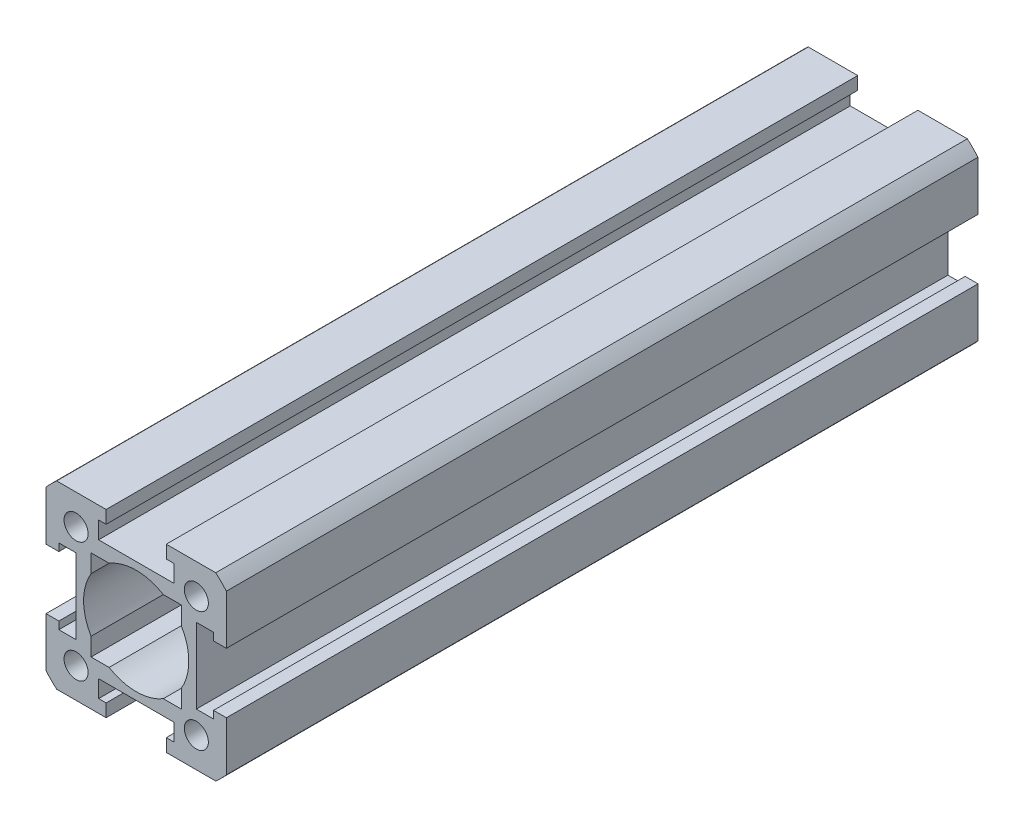
from build123d import *

# Parameters (mm, degrees)
SKETCH1_R           = 1.6
BOSS_EXTRUDE1_DEPTH = 100


with BuildPart() as part:
    # Sketch1 → Boss-Extrude1 (new body)
    with BuildSketch(Plane.XY):
        with BuildLine():
            Line((-8, -5), (-10.291177135, -5))
            Line((-10.291177135, -5), (-10.291177135, -4))
            Line((-10.291177135, -4), (-12, -4))
            Line((-12, -4), (-12, -10.583005244))
            ThreePointArc((-12, -10.583005244), (-11.313708499, -11.313708499), (-10.583005244, -12))
            Line((-10.583005244, -12), (-4, -12))
            Line((-4, -12), (-4, -10.291177135))
            Line((-4, -10.291177135), (-5, -10.291177135))
            Line((-5, -10.291177135), (-5, -8))
            Line((-5, -8), (5, -8))
            Line((5, -8), (5, -10.291177135))
            Line((5, -10.291177135), (4, -10.291177135))
            Line((4, -10.291177135), (4, -12))
            Line((4, -12), (10.583005244, -12))
            ThreePointArc((10.583005244, -12), (11.313708499, -11.313708499), (12, -10.583005244))
            Line((12, -10.583005244), (12, -4))
            Line((12, -4), (10.291177135, -4))
            Line((10.291177135, -4), (10.291177135, -5))
            Line((10.291177135, -5), (8, -5))
            Line((8, -5), (8, 5))
            Line((8, 5), (10.291177135, 5))
            Line((10.291177135, 5), (10.291177135, 4))
            Line((10.291177135, 4), (12, 4))
            Line((12, 4), (12, 10.583005244))
            ThreePointArc((12, 10.583005244), (11.313708499, 11.313708499), (10.583005244, 12))
            Line((10.583005244, 12), (4, 12))
            Line((4, 12), (4, 10.291177135))
            Line((4, 10.291177135), (5, 10.291177135))
            Line((5, 10.291177135), (5, 8))
            Line((5, 8), (-5, 8))
            Line((-5, 8), (-5, 10.291177135))
            Line((-5, 10.291177135), (-4, 10.291177135))
            Line((-4, 10.291177135), (-4, 12))
            Line((-4, 12), (-10.583005244, 12))
            ThreePointArc((-10.583005244, 12), (-11.313708499, 11.313708499), (-12, 10.583005244))
            Line((-12, 10.583005244), (-12, 4))
            Line((-12, 4), (-10.291177135, 4))
            Line((-10.291177135, 4), (-10.291177135, 5))
            Line((-10.291177135, 5), (-8, 5))
            Line((-8, 5), (-8, -5))
        make_face()
        with Locations((-8, -8)):
            Circle(SKETCH1_R, mode=Mode.SUBTRACT)
        with Locations((8, 8)):
            Circle(SKETCH1_R, mode=Mode.SUBTRACT)
        with Locations((-8, 8)):
            Circle(SKETCH1_R, mode=Mode.SUBTRACT)
        with Locations((8, -8)):
            Circle(SKETCH1_R, mode=Mode.SUBTRACT)
        with BuildLine():
            Line((-3.605551275, -6), (-6, -6))
            Line((-6, -6), (-6, -3.605551275))
            ThreePointArc((-6, -3.605551275), (-7, 0), (-6, 3.605551275))
            Line((-6, 3.605551275), (-6, 6))
            Line((-6, 6), (-3.605551275, 6))
            ThreePointArc((-3.605551275, 6), (0, 7), (3.605551275, 6))
            Line((3.605551275, 6), (6, 6))
            Line((6, 6), (6, 3.605551275))
            ThreePointArc((6, 3.605551275), (7, 0), (6, -3.605551275))
            Line((6, -3.605551275), (6, -6))
            Line((6, -6), (3.605551275, -6))
            ThreePointArc((3.605551275, -6), (0, -7), (-3.605551275, -6))
        make_face(mode=Mode.SUBTRACT)
    extrude(amount=BOSS_EXTRUDE1_DEPTH)


solid = part.part
